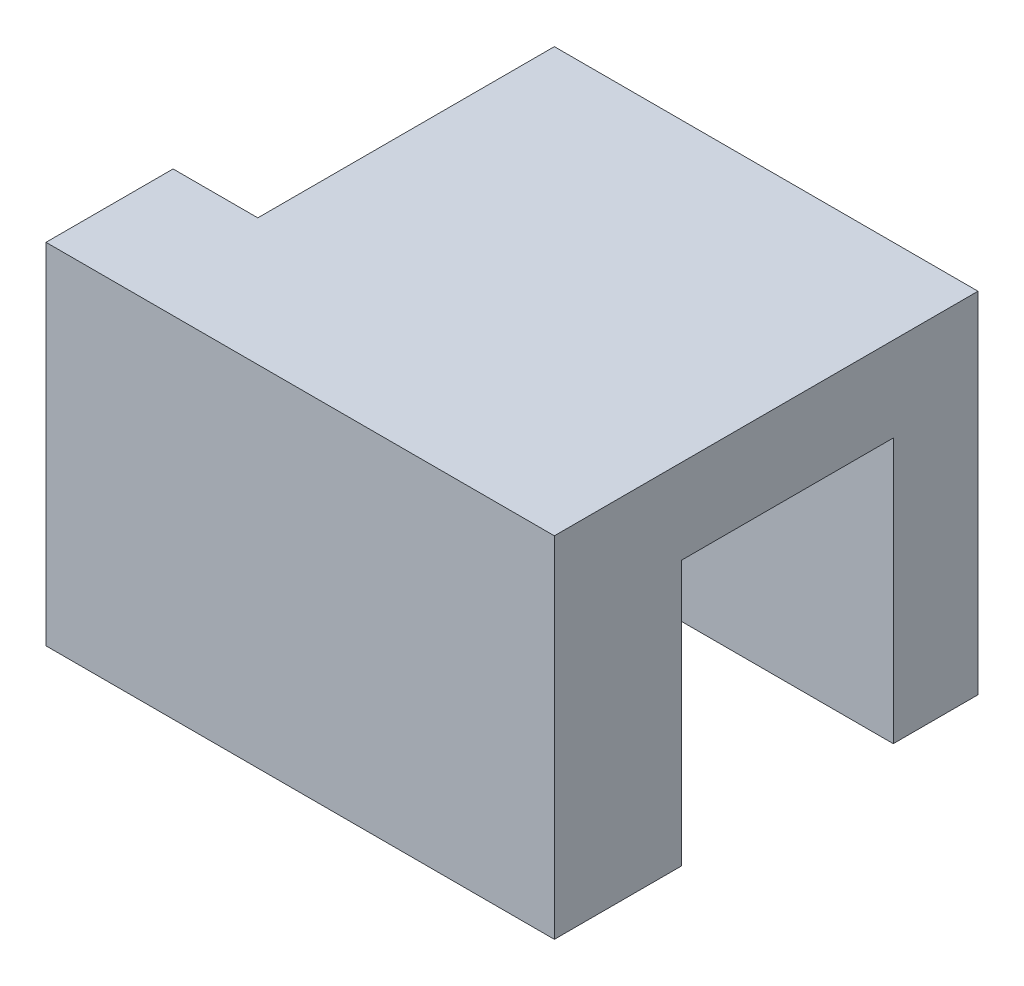
from build123d import *

# Parameters (mm, degrees)
BOSS_EXTRUDE1_DEPTH = 12.5
BOSS_EXTRUDE4_DEPTH = 20
BOSS_EXTRUDE5_DEPTH = 4


with BuildPart() as part:
    # Sketch1 → Boss-Extrude1 (new body)
    with BuildSketch(Plane(origin=(0, 0, 0), x_dir=(1, 0, 0), z_dir=(0, 1, 0))):
        Polygon((-2.564516129, 3.29516129), (14.435483871, 3.29516129), (14.435483871, -2.70483871), (-5.564516129, -2.70483871), (-5.564516129, 3.29516129), (-4.064516129, 3.29516129), align=None)
    extrude(amount=BOSS_EXTRUDE1_DEPTH)

    # Sketch2 → Boss-Extrude4 (add)
    with BuildSketch(Plane(origin=(14.435483871, 0, 0), x_dir=(0, 0, -1), z_dir=(1, 0, 0))):
        Polygon((-2.70483871, 12.5), (13.29516129, 12.5), (13.29516129, 0), (17.29516129, 0), (17.29516129, 12.5), (17.29516129, 16.5), (-2.70483871, 16.5), align=None)
    extrude(amount=-BOSS_EXTRUDE4_DEPTH)

    # Sketch5 → Boss-Extrude5 (add)
    with BuildSketch(Plane.ZY.offset(5.564516129)):
        Polygon((-3.29516129, 0), (2.70483871, 0), (2.70483871, 16.5), (-3.29516129, 16.5), (-3.29516129, 11.338834765), (0.543673475, 7.5), (-3.29516129, 3.661165235), align=None)
    extrude(amount=BOSS_EXTRUDE5_DEPTH)


solid = part.part
